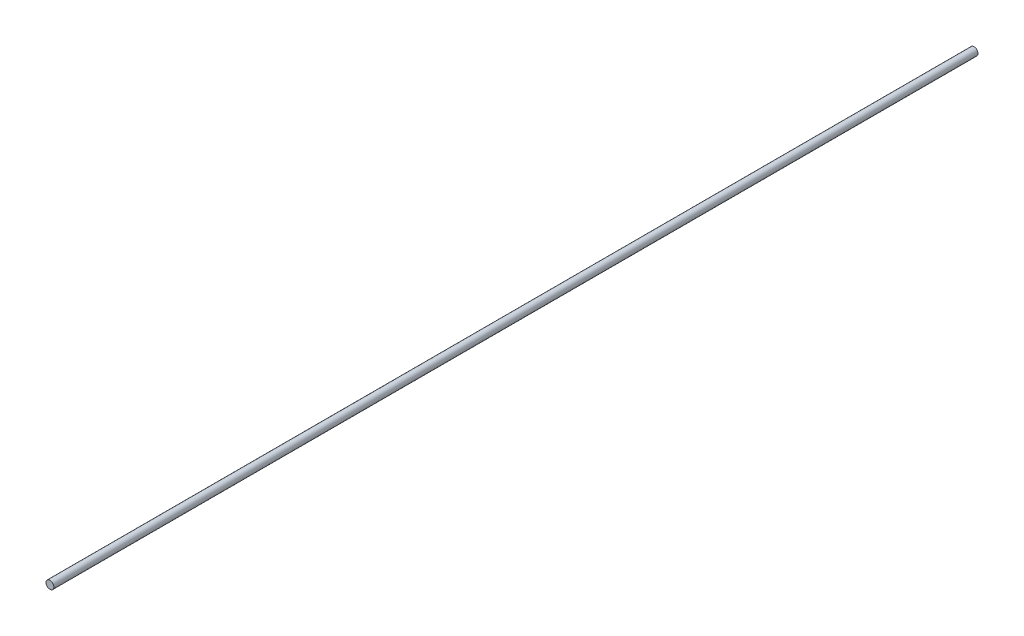
from build123d import *

# Parameters (mm, degrees)
SKETCH1_R           = 8.89
BOSS_EXTRUDE1_DEPTH = 2094.656901781


with BuildPart() as part:
    # Sketch1 → Boss-Extrude1 (new body)
    with BuildSketch(Plane.XY):
        Circle(SKETCH1_R)
    extrude(amount=BOSS_EXTRUDE1_DEPTH)


solid = part.part
